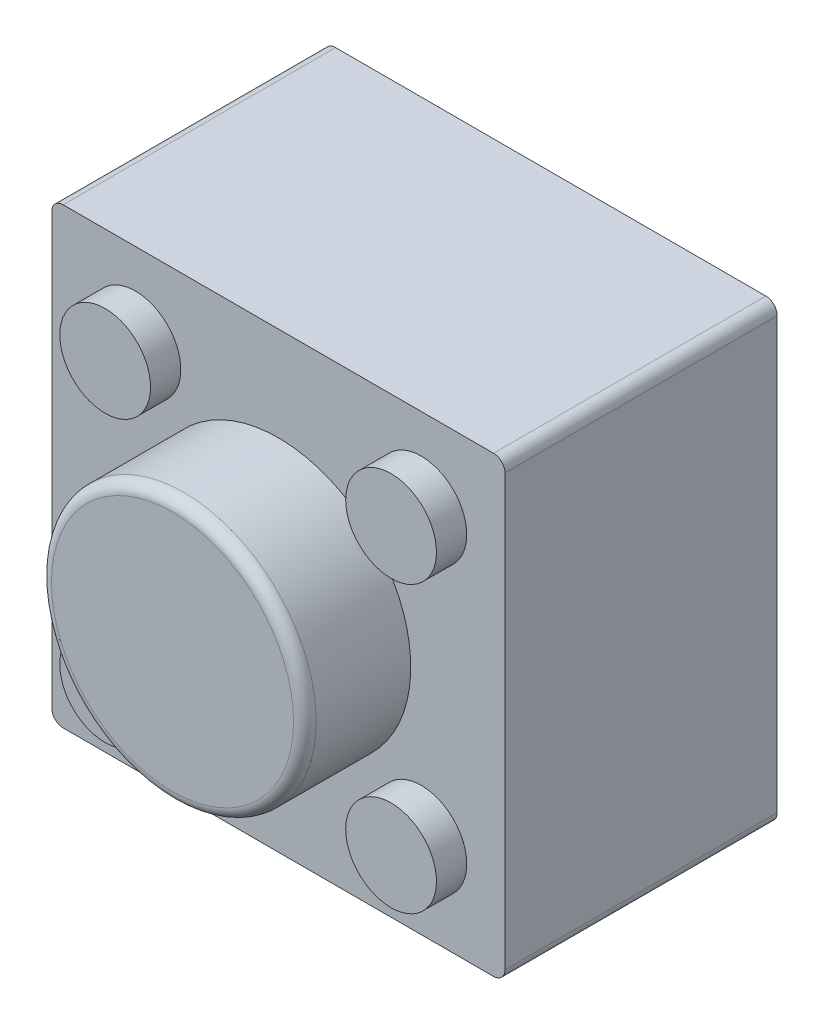
from build123d import *

# Parameters (mm, degrees)
SKETCH2_W           = 5.99
SKETCH2_H           = 5.99
BOSS_EXTRUDE1_DEPTH = 3.6
SKETCH3_R           = 1.75
BOSS_EXTRUDE2_DEPTH = 1.4
FILLET1_R           = 0.15
SKETCH5_R           = 0.6
BOSS_EXTRUDE3_DEPTH = 0.4


with BuildPart() as part:
    # Sketch2 → Boss-Extrude1 (new body)
    with BuildSketch(Plane.XY):
        with Locations((2.995, 2.995)):
            Rectangle(SKETCH2_W, SKETCH2_H)
    extrude(amount=BOSS_EXTRUDE1_DEPTH)

    # Sketch3 → Boss-Extrude2 (add)
    with BuildSketch(Plane.XY.offset(3.6)):
        with Locations(Location((2.995, 2.995, 0), (0, 0, 180))):
            Circle(SKETCH3_R)
    extrude(amount=BOSS_EXTRUDE2_DEPTH)

    # Fillet1
    fillet1_edges = [part.edges().sort_by_distance(p)[0] for p in [
        (4.745, 2.995, 5),
        (0, 5.99, 1.8),
        (5.99, 5.99, 1.8),
        (5.99, 0, 1.8),
        (0, 0, 1.8),
    ]]
    fillet(fillet1_edges, radius=FILLET1_R)

    # Sketch5 → Boss-Extrude3 (add)
    with BuildSketch(Plane.XY.offset(3.6)):
        with Locations(Location((1.105, 4.88, 0), (0, 0, 180))):
            Circle(SKETCH5_R)
        with Locations(Location((4.885, 4.88, 0), (0, 0, 180))):
            Circle(SKETCH5_R)
        with Locations(Location((4.885, 1.11, 0), (0, 0, 180))):
            Circle(SKETCH5_R)
        with Locations(Location((1.105, 1.11, 0), (0, 0, 180))):
            Circle(SKETCH5_R)
    extrude(amount=BOSS_EXTRUDE3_DEPTH)


solid = part.part
